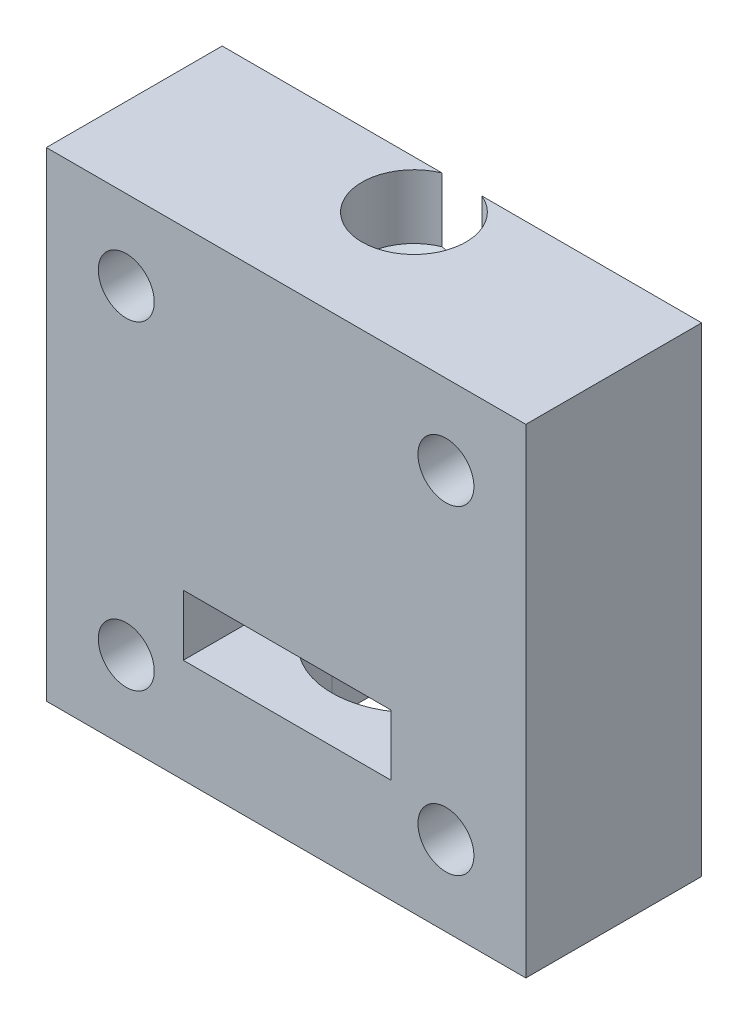
from build123d import *

# Parameters (mm, degrees)
SKETCH1_W                                        = 30
SKETCH1_H                                        = 30
BOSS_EXTRUDE1_DEPTH                              = 11
CUT_EXTRUDE1_DEPTH                               = 1.55
CUT_EXTRUDE2_DEPTH                               = 31.712375356
SKETCH7_W                                        = 5.55
SKETCH7_H                                        = 1.8
CUT_EXTRUDE3_DEPTH                               = 5.55
CBORE_FOR_M3_HEX_HEAD_MACHINE_SCREW1_D           = 3.5
CBORE_FOR_M3_HEX_HEAD_MACHINE_SCREW1_CBORE_D     = 6.5
CBORE_FOR_M3_HEX_HEAD_MACHINE_SCREW1_CBORE_DEPTH = 4
SKETCH10_W                                       = 1.7
SKETCH10_H                                       = 12.55
CUT_EXTRUDE4_DEPTH                               = 1.8
CUT_EXTRUDE4_DEPTH_BACK                          = 2
SKETCH14_W                                       = 13
SKETCH14_H                                       = 30


with BuildPart() as part:
    # Sketch1 → Boss-Extrude1 (new body)
    with BuildSketch(Plane(origin=(0, 0, 5), x_dir=(-1, 0, 0), z_dir=(0, 0, -1))):
        Rectangle(SKETCH1_W, SKETCH1_H)
    extrude(amount=-BOSS_EXTRUDE1_DEPTH)

    # Sketch2 → Cut-Extrude1 (cut)
    with BuildSketch(Plane(origin=(0, -4.95, 0), x_dir=(1, 0, 0), z_dir=(0, 1, 0))):
        with BuildLine():
            Line((7.432729441, -5), (-7.432729441, -5))
            ThreePointArc((-7.432729441, -5), (-7.633699531, -5.794473784), (-7.75, -6.605677687))
            Line((-7.75, -6.605677687), (-7.75, -8))
            ThreePointArc((-7.75, -8), (1.508365059, -14.936538374), (7.432729441, -5))
        make_face()
    extrude(amount=-CUT_EXTRUDE1_DEPTH, mode=Mode.SUBTRACT)

    # Sketch3 → Cut-Extrude2 (cut, through all)
    with BuildSketch(Plane(origin=(0, -6.5, 0), x_dir=(-1, 0, 0), z_dir=(0, 1, 0))):
        with BuildLine():
            Line((-5.125, 5), (5.125, 5))
            Line((5.125, 5), (5.125, 8))
            ThreePointArc((5.125, 8), (0, 13.125), (-5.125, 8))
            Line((-5.125, 8), (-5.125, 5))
        make_face()
    extrude(amount=-CUT_EXTRUDE2_DEPTH, mode=Mode.SUBTRACT)

    # Sketch7 → Cut-Extrude3 (cut)
    with BuildSketch(Plane(origin=(0, 0, 5), x_dir=(-1, 0, 0), z_dir=(0, 0, -1))):
        with Locations((0, -1.55)):
            Rectangle(SKETCH7_W, SKETCH7_H)
    extrude(amount=-CUT_EXTRUDE3_DEPTH, mode=Mode.SUBTRACT)

    # CBORE for M3 Hex Head Machine Screw1 (through all)
    with Locations(Plane(origin=(0, 0, 5), x_dir=(-1, 0, 0), z_dir=(0, 0, -1))):
        with Locations((-10, 10), (-10, -10), (10, -10), (10, 10)):
            CounterBoreHole(CBORE_FOR_M3_HEX_HEAD_MACHINE_SCREW1_D / 2, CBORE_FOR_M3_HEX_HEAD_MACHINE_SCREW1_CBORE_D / 2, CBORE_FOR_M3_HEX_HEAD_MACHINE_SCREW1_CBORE_DEPTH)

    # Sketch10 → Ø3.4 (3.4) Diameter Hole1 (revolve, cut)
    with BuildSketch(Plane(origin=(0, -2.45, 8), x_dir=(0, 0, 1), z_dir=(1, 0, 0))):
        with Locations((0.85, 6.275)):
            Rectangle(SKETCH10_W, SKETCH10_H)
    revolve(axis=Axis((0, 3.9, 8), (0, -1, 0)), mode=Mode.SUBTRACT)

    # Sketch12 → CSK for M3 Flat Head Machine Screw1 (revolve, cut)
    with BuildSketch(Plane(origin=(0, 15, 8), x_dir=(0, 0, 1), z_dir=(1, 0, 0))):
        Polygon((0, 0), (0, 30), (1.7, 30), (1.7, 4.931333959), (3.25, 4), (3.25, 0), align=None)
    revolve(axis=Axis((0, 21.35, 8), (0, -1, 0)), mode=Mode.SUBTRACT)

    # Sketch14 → Cut-Extrude4 (cut, two sides: drawn at the far end of the back side and taken through both)
    with BuildSketch(Plane(origin=(0, -6.5, 0), x_dir=(-1, 0, 0), z_dir=(0, 1, 0)).offset(-CUT_EXTRUDE4_DEPTH_BACK)):
        with Locations((-0.068435325, 5)):
            Rectangle(SKETCH14_W, SKETCH14_H)
    extrude(amount=CUT_EXTRUDE4_DEPTH + CUT_EXTRUDE4_DEPTH_BACK, mode=Mode.SUBTRACT)


solid = part.part
